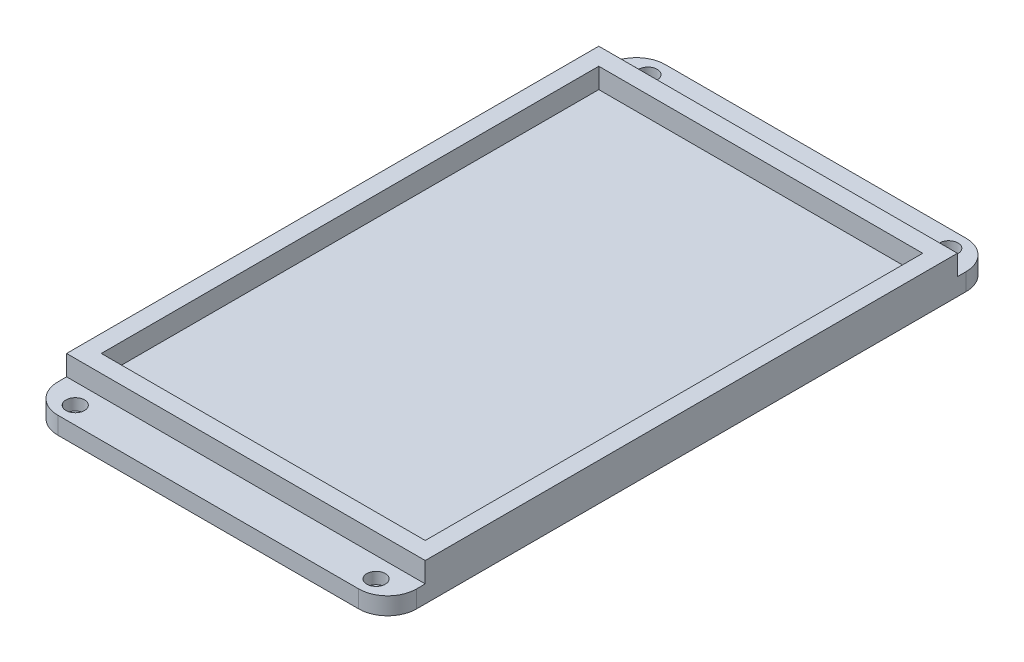
from build123d import *

# Parameters (mm, degrees)
SKETCH_1_W          = 62
SKETCH_1_H          = 92
SKETCH_1_W_2        = 56
SKETCH_1_H_2        = 86
EXTRUDE_1_DEPTH     = 3.5
SKETCH_2_W          = 62
SKETCH_2_H          = 105
EXTRUDE_2_DEPTH     = 3
FILLET_2_R          = 5
SKETCH_3_R          = 1.6
CUT_EXTRUDE_1_DEPTH = 2


with BuildPart() as part:
    # 草图1 → 凸台-拉伸1 (new body)
    with BuildSketch(Plane(origin=(0, 0, 0), x_dir=(1, 0, 0), z_dir=(0, 1, 0))):
        Rectangle(SKETCH_1_W, SKETCH_1_H)
        Rectangle(SKETCH_1_W_2, SKETCH_1_H_2, mode=Mode.SUBTRACT)
    extrude(amount=EXTRUDE_1_DEPTH)

    # 草图2 → 凸台-拉伸2 (add)
    with BuildSketch(Plane.XZ):
        Rectangle(SKETCH_2_W, SKETCH_2_H)
    extrude(amount=EXTRUDE_2_DEPTH)

    # 圆角2
    fillet_2_edges = [part.edges().sort_by_distance(p)[0] for p in [
        (31, -1.5, -52.5),
        (31, -1.5, 52.5),
        (-31, -1.5, 52.5),
        (-31, -1.5, -52.5),
    ]]
    fillet(fillet_2_edges, radius=FILLET_2_R)

    # 草图3 → 切除-拉伸1 (cut)
    with BuildSketch(Plane(origin=(0, 0, 0), x_dir=(1, 0, 0), z_dir=(0, 1, 0))):
        with Locations(Location((-26, 49.5, 0), (0, 0, 270))):
            Circle(SKETCH_3_R)
        with Locations(Location((26, 49.5, 0), (0, 0, 90))):
            Circle(SKETCH_3_R)
        with Locations(Location((26, -49.5, 0), (0, 0, 270))):
            Circle(SKETCH_3_R)
        with Locations(Location((-26, -49.5, 0), (0, 0, 90))):
            Circle(SKETCH_3_R)
    extrude(amount=-CUT_EXTRUDE_1_DEPTH, mode=Mode.SUBTRACT)


solid = part.part
